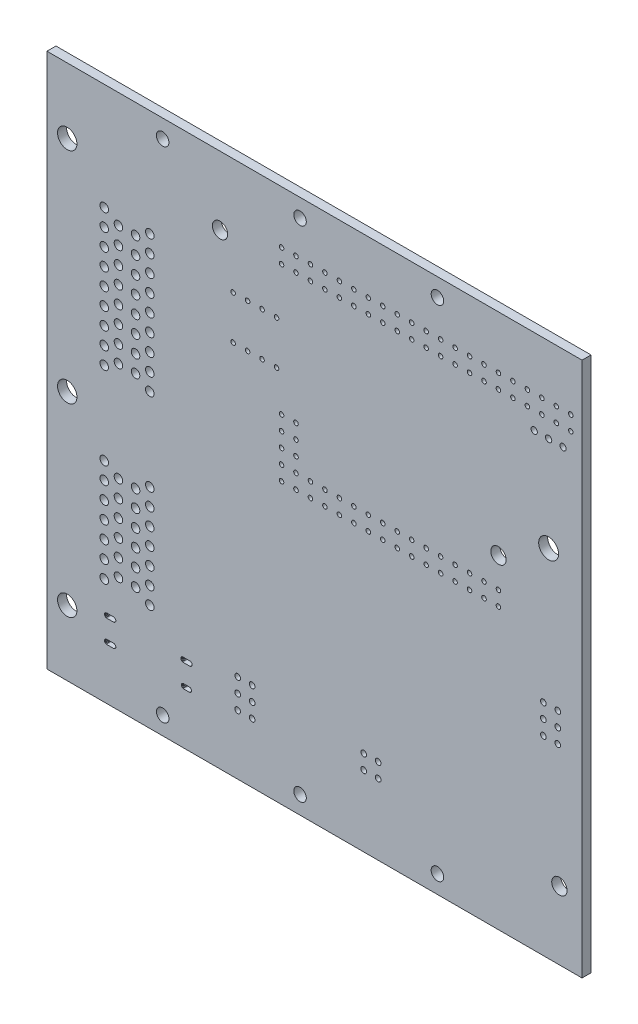
from build123d import *

# Parameters (mm, degrees)
SKETCH1_W           = 93.98
SKETCH1_H           = 93.98
SKETCH1_R           = 1.7
SKETCH1_R_2         = 1.1
SKETCH1_R_3         = 0.75
SKETCH1_R_4         = 1.35
SKETCH1_R_5         = 0.4
SKETCH1_R_6         = 0.55
SKETCH1_R_7         = 1.75
SKETCH1_R_8         = 0.5
BOSS_EXTRUDE1_DEPTH = 1.58


with BuildPart() as part:
    # Sketch1 → Boss-Extrude1 (new body)
    with BuildSketch(Plane.XY.offset(1.58)):
        with Locations((93.064, -92.796)):
            Rectangle(SKETCH1_W, SKETCH1_H)
        with Locations((49.633992, -57.295988)):
            Circle(SKETCH1_R, mode=Mode.SUBTRACT)
        with Locations((66.394, -48.981)):
            Circle(SKETCH1_R_2, mode=Mode.SUBTRACT)
        with Locations((56.133992, -64.545988)):
            Circle(SKETCH1_R_3, mode=Mode.SUBTRACT)
        with Locations((56.133992, -67.545988)):
            Circle(SKETCH1_R_3, mode=Mode.SUBTRACT)
        with Locations((58.633992, -66.045988)):
            Circle(SKETCH1_R_3, mode=Mode.SUBTRACT)
        with Locations((56.133992, -70.545988)):
            Circle(SKETCH1_R_3, mode=Mode.SUBTRACT)
        with Locations((58.633992, -69.045988)):
            Circle(SKETCH1_R_3, mode=Mode.SUBTRACT)
        with Locations((64.133992, -64.545988)):
            Circle(SKETCH1_R_3, mode=Mode.SUBTRACT)
        with Locations((61.633992, -66.045988)):
            Circle(SKETCH1_R_3, mode=Mode.SUBTRACT)
        with Locations((64.133992, -67.545988)):
            Circle(SKETCH1_R_3, mode=Mode.SUBTRACT)
        with Locations((61.633992, -69.045988)):
            Circle(SKETCH1_R_3, mode=Mode.SUBTRACT)
        with Locations((64.133992, -70.545988)):
            Circle(SKETCH1_R_3, mode=Mode.SUBTRACT)
        with Locations((76.474, -57.806)):
            Circle(SKETCH1_R_4, mode=Mode.SUBTRACT)
        with Locations((90.524, -48.981)):
            Circle(SKETCH1_R_2, mode=Mode.SUBTRACT)
        with Locations(Location((87.274, -55.066, 0), (0, 0, 180))):
            Circle(SKETCH1_R_5, mode=Mode.SUBTRACT)
        with Locations(Location((87.274, -57.606, 0), (0, 0, 180))):
            Circle(SKETCH1_R_5, mode=Mode.SUBTRACT)
        with Locations(Location((89.814, -55.066, 0), (0, 0, 180))):
            Circle(SKETCH1_R_5, mode=Mode.SUBTRACT)
        with Locations(Location((92.354, -55.066, 0), (0, 0, 180))):
            Circle(SKETCH1_R_5, mode=Mode.SUBTRACT)
        with Locations(Location((89.814, -57.606, 0), (0, 0, 180))):
            Circle(SKETCH1_R_5, mode=Mode.SUBTRACT)
        with Locations(Location((92.354, -57.606, 0), (0, 0, 180))):
            Circle(SKETCH1_R_5, mode=Mode.SUBTRACT)
        with Locations(Location((78.774, -66.1535, 0), (0, 0, 180))):
            Circle(SKETCH1_R_5, mode=Mode.SUBTRACT)
        with Locations(Location((81.314, -66.1535, 0), (0, 0, 180))):
            Circle(SKETCH1_R_5, mode=Mode.SUBTRACT)
        with Locations(Location((83.854, -66.1535, 0), (0, 0, 180))):
            Circle(SKETCH1_R_5, mode=Mode.SUBTRACT)
        with Locations(Location((86.394, -66.1535, 0), (0, 0, 180))):
            Circle(SKETCH1_R_5, mode=Mode.SUBTRACT)
        with Locations((56.133992, -73.545988)):
            Circle(SKETCH1_R_3, mode=Mode.SUBTRACT)
        with Locations((58.633992, -72.045988)):
            Circle(SKETCH1_R_3, mode=Mode.SUBTRACT)
        with Locations((58.633992, -75.045988)):
            Circle(SKETCH1_R_3, mode=Mode.SUBTRACT)
        with Locations((56.133992, -76.545988)):
            Circle(SKETCH1_R_3, mode=Mode.SUBTRACT)
        with Locations((58.633992, -78.045988)):
            Circle(SKETCH1_R_3, mode=Mode.SUBTRACT)
        with Locations((56.133992, -79.545988)):
            Circle(SKETCH1_R_3, mode=Mode.SUBTRACT)
        with Locations((58.633992, -81.045988)):
            Circle(SKETCH1_R_3, mode=Mode.SUBTRACT)
        with Locations((61.633992, -72.045988)):
            Circle(SKETCH1_R_3, mode=Mode.SUBTRACT)
        with Locations((64.133992, -73.545988)):
            Circle(SKETCH1_R_3, mode=Mode.SUBTRACT)
        with Locations((61.633992, -75.045988)):
            Circle(SKETCH1_R_3, mode=Mode.SUBTRACT)
        with Locations((61.633992, -78.045988)):
            Circle(SKETCH1_R_3, mode=Mode.SUBTRACT)
        with Locations((64.133992, -76.545988)):
            Circle(SKETCH1_R_3, mode=Mode.SUBTRACT)
        with Locations((61.633992, -81.045988)):
            Circle(SKETCH1_R_3, mode=Mode.SUBTRACT)
        with Locations((64.133992, -79.545988)):
            Circle(SKETCH1_R_3, mode=Mode.SUBTRACT)
        with Locations((56.133992, -82.545988)):
            Circle(SKETCH1_R_3, mode=Mode.SUBTRACT)
        with Locations((58.633992, -84.045988)):
            Circle(SKETCH1_R_3, mode=Mode.SUBTRACT)
        with Locations((56.133992, -85.545988)):
            Circle(SKETCH1_R_3, mode=Mode.SUBTRACT)
        with Locations((58.633992, -87.045988)):
            Circle(SKETCH1_R_3, mode=Mode.SUBTRACT)
        with Locations((56.133992, -88.545988)):
            Circle(SKETCH1_R_3, mode=Mode.SUBTRACT)
        with Locations((61.633992, -84.045988)):
            Circle(SKETCH1_R_3, mode=Mode.SUBTRACT)
        with Locations((64.133992, -82.545988)):
            Circle(SKETCH1_R_3, mode=Mode.SUBTRACT)
        with Locations((61.633992, -87.045988)):
            Circle(SKETCH1_R_3, mode=Mode.SUBTRACT)
        with Locations((64.133992, -85.545988)):
            Circle(SKETCH1_R_3, mode=Mode.SUBTRACT)
        with Locations((64.133992, -88.545988)):
            Circle(SKETCH1_R_3, mode=Mode.SUBTRACT)
        with Locations(Location((78.774, -73.7735, 0), (0, 0, 180))):
            Circle(SKETCH1_R_5, mode=Mode.SUBTRACT)
        with Locations(Location((81.314, -73.7735, 0), (0, 0, 180))):
            Circle(SKETCH1_R_5, mode=Mode.SUBTRACT)
        with Locations(Location((83.854, -73.7735, 0), (0, 0, 180))):
            Circle(SKETCH1_R_5, mode=Mode.SUBTRACT)
        with Locations(Location((86.394, -73.7735, 0), (0, 0, 180))):
            Circle(SKETCH1_R_5, mode=Mode.SUBTRACT)
        with Locations(Location((87.274, -80.466, 0), (0, 0, 180))):
            Circle(SKETCH1_R_5, mode=Mode.SUBTRACT)
        with Locations(Location((89.814, -80.466, 0), (0, 0, 180))):
            Circle(SKETCH1_R_5, mode=Mode.SUBTRACT)
        with Locations(Location((87.274, -83.006, 0), (0, 0, 180))):
            Circle(SKETCH1_R_5, mode=Mode.SUBTRACT)
        with Locations(Location((87.274, -85.546, 0), (0, 0, 180))):
            Circle(SKETCH1_R_5, mode=Mode.SUBTRACT)
        with Locations(Location((89.814, -83.006, 0), (0, 0, 180))):
            Circle(SKETCH1_R_5, mode=Mode.SUBTRACT)
        with Locations(Location((89.814, -85.546, 0), (0, 0, 180))):
            Circle(SKETCH1_R_5, mode=Mode.SUBTRACT)
        with Locations(Location((87.274, -88.086, 0), (0, 0, 180))):
            Circle(SKETCH1_R_5, mode=Mode.SUBTRACT)
        with Locations(Location((87.274, -90.626, 0), (0, 0, 180))):
            Circle(SKETCH1_R_5, mode=Mode.SUBTRACT)
        with Locations(Location((89.814, -88.086, 0), (0, 0, 180))):
            Circle(SKETCH1_R_5, mode=Mode.SUBTRACT)
        with Locations(Location((92.354, -88.086, 0), (0, 0, 180))):
            Circle(SKETCH1_R_5, mode=Mode.SUBTRACT)
        with Locations(Location((89.814, -90.626, 0), (0, 0, 180))):
            Circle(SKETCH1_R_5, mode=Mode.SUBTRACT)
        with Locations(Location((92.354, -90.626, 0), (0, 0, 180))):
            Circle(SKETCH1_R_5, mode=Mode.SUBTRACT)
        with Locations(Location((94.894, -55.066, 0), (0, 0, 180))):
            Circle(SKETCH1_R_5, mode=Mode.SUBTRACT)
        with Locations(Location((97.434, -55.066, 0), (0, 0, 180))):
            Circle(SKETCH1_R_5, mode=Mode.SUBTRACT)
        with Locations(Location((94.894, -57.606, 0), (0, 0, 180))):
            Circle(SKETCH1_R_5, mode=Mode.SUBTRACT)
        with Locations(Location((97.434, -57.606, 0), (0, 0, 180))):
            Circle(SKETCH1_R_5, mode=Mode.SUBTRACT)
        with Locations(Location((99.974, -55.066, 0), (0, 0, 180))):
            Circle(SKETCH1_R_5, mode=Mode.SUBTRACT)
        with Locations(Location((102.514, -55.066, 0), (0, 0, 180))):
            Circle(SKETCH1_R_5, mode=Mode.SUBTRACT)
        with Locations(Location((99.974, -57.606, 0), (0, 0, 180))):
            Circle(SKETCH1_R_5, mode=Mode.SUBTRACT)
        with Locations(Location((102.514, -57.606, 0), (0, 0, 180))):
            Circle(SKETCH1_R_5, mode=Mode.SUBTRACT)
        with Locations(Location((105.054, -55.066, 0), (0, 0, 180))):
            Circle(SKETCH1_R_5, mode=Mode.SUBTRACT)
        with Locations(Location((107.594, -55.066, 0), (0, 0, 180))):
            Circle(SKETCH1_R_5, mode=Mode.SUBTRACT)
        with Locations(Location((110.134, -55.066, 0), (0, 0, 180))):
            Circle(SKETCH1_R_5, mode=Mode.SUBTRACT)
        with Locations(Location((105.054, -57.606, 0), (0, 0, 180))):
            Circle(SKETCH1_R_5, mode=Mode.SUBTRACT)
        with Locations(Location((107.594, -57.606, 0), (0, 0, 180))):
            Circle(SKETCH1_R_5, mode=Mode.SUBTRACT)
        with Locations(Location((110.134, -57.606, 0), (0, 0, 180))):
            Circle(SKETCH1_R_5, mode=Mode.SUBTRACT)
        with Locations(Location((112.674, -55.066, 0), (0, 0, 180))):
            Circle(SKETCH1_R_5, mode=Mode.SUBTRACT)
        with Locations(Location((115.214, -55.066, 0), (0, 0, 180))):
            Circle(SKETCH1_R_5, mode=Mode.SUBTRACT)
        with Locations(Location((112.674, -57.606, 0), (0, 0, 180))):
            Circle(SKETCH1_R_5, mode=Mode.SUBTRACT)
        with Locations(Location((115.214, -57.606, 0), (0, 0, 180))):
            Circle(SKETCH1_R_5, mode=Mode.SUBTRACT)
        with Locations((114.654, -48.981)):
            Circle(SKETCH1_R_2, mode=Mode.SUBTRACT)
        with Locations(Location((117.754, -55.066, 0), (0, 0, 180))):
            Circle(SKETCH1_R_5, mode=Mode.SUBTRACT)
        with Locations(Location((120.294, -55.066, 0), (0, 0, 180))):
            Circle(SKETCH1_R_5, mode=Mode.SUBTRACT)
        with Locations(Location((117.754, -57.606, 0), (0, 0, 180))):
            Circle(SKETCH1_R_5, mode=Mode.SUBTRACT)
        with Locations(Location((120.294, -57.606, 0), (0, 0, 180))):
            Circle(SKETCH1_R_5, mode=Mode.SUBTRACT)
        with Locations(Location((122.834, -55.066, 0), (0, 0, 180))):
            Circle(SKETCH1_R_5, mode=Mode.SUBTRACT)
        with Locations(Location((125.374, -55.066, 0), (0, 0, 180))):
            Circle(SKETCH1_R_5, mode=Mode.SUBTRACT)
        with Locations(Location((122.834, -57.606, 0), (0, 0, 180))):
            Circle(SKETCH1_R_5, mode=Mode.SUBTRACT)
        with Locations(Location((125.374, -57.606, 0), (0, 0, 180))):
            Circle(SKETCH1_R_5, mode=Mode.SUBTRACT)
        with Locations(Location((127.914, -55.066, 0), (0, 0, 180))):
            Circle(SKETCH1_R_5, mode=Mode.SUBTRACT)
        with Locations(Location((130.454, -55.066, 0), (0, 0, 180))):
            Circle(SKETCH1_R_5, mode=Mode.SUBTRACT)
        with Locations(Location((127.914, -57.606, 0), (0, 0, 180))):
            Circle(SKETCH1_R_5, mode=Mode.SUBTRACT)
        with Locations(Location((130.454, -57.606, 0), (0, 0, 180))):
            Circle(SKETCH1_R_5, mode=Mode.SUBTRACT)
        with Locations(Location((132.994, -55.066, 0), (0, 0, 180))):
            Circle(SKETCH1_R_5, mode=Mode.SUBTRACT)
        with Locations(Location((135.534, -55.066, 0), (0, 0, 180))):
            Circle(SKETCH1_R_5, mode=Mode.SUBTRACT)
        with Locations(Location((138.074, -55.066, 0), (0, 0, 180))):
            Circle(SKETCH1_R_5, mode=Mode.SUBTRACT)
        with Locations(Location((132.994, -57.606, 0), (0, 0, 180))):
            Circle(SKETCH1_R_5, mode=Mode.SUBTRACT)
        with Locations(Location((135.534, -57.606, 0), (0, 0, 180))):
            Circle(SKETCH1_R_5, mode=Mode.SUBTRACT)
        with Locations(Location((138.074, -57.606, 0), (0, 0, 180))):
            Circle(SKETCH1_R_5, mode=Mode.SUBTRACT)
        with Locations(Location((131.644, -60.706, 0), (0, 0, 180))):
            Circle(SKETCH1_R_6, mode=Mode.SUBTRACT)
        with Locations(Location((134.184, -60.706, 0), (0, 0, 180))):
            Circle(SKETCH1_R_6, mode=Mode.SUBTRACT)
        with Locations(Location((136.724, -60.706, 0), (0, 0, 180))):
            Circle(SKETCH1_R_6, mode=Mode.SUBTRACT)
        with Locations(Location((94.894, -88.086, 0), (0, 0, 180))):
            Circle(SKETCH1_R_5, mode=Mode.SUBTRACT)
        with Locations(Location((97.434, -88.086, 0), (0, 0, 180))):
            Circle(SKETCH1_R_5, mode=Mode.SUBTRACT)
        with Locations(Location((94.894, -90.626, 0), (0, 0, 180))):
            Circle(SKETCH1_R_5, mode=Mode.SUBTRACT)
        with Locations(Location((97.434, -90.626, 0), (0, 0, 180))):
            Circle(SKETCH1_R_5, mode=Mode.SUBTRACT)
        with Locations(Location((99.974, -88.086, 0), (0, 0, 180))):
            Circle(SKETCH1_R_5, mode=Mode.SUBTRACT)
        with Locations(Location((102.514, -88.086, 0), (0, 0, 180))):
            Circle(SKETCH1_R_5, mode=Mode.SUBTRACT)
        with Locations(Location((99.974, -90.626, 0), (0, 0, 180))):
            Circle(SKETCH1_R_5, mode=Mode.SUBTRACT)
        with Locations(Location((102.514, -90.626, 0), (0, 0, 180))):
            Circle(SKETCH1_R_5, mode=Mode.SUBTRACT)
        with Locations(Location((105.054, -88.086, 0), (0, 0, 180))):
            Circle(SKETCH1_R_5, mode=Mode.SUBTRACT)
        with Locations(Location((107.594, -88.086, 0), (0, 0, 180))):
            Circle(SKETCH1_R_5, mode=Mode.SUBTRACT)
        with Locations(Location((110.134, -88.086, 0), (0, 0, 180))):
            Circle(SKETCH1_R_5, mode=Mode.SUBTRACT)
        with Locations(Location((105.054, -90.626, 0), (0, 0, 180))):
            Circle(SKETCH1_R_5, mode=Mode.SUBTRACT)
        with Locations(Location((107.594, -90.626, 0), (0, 0, 180))):
            Circle(SKETCH1_R_5, mode=Mode.SUBTRACT)
        with Locations(Location((110.134, -90.626, 0), (0, 0, 180))):
            Circle(SKETCH1_R_5, mode=Mode.SUBTRACT)
        with Locations(Location((112.674, -88.086, 0), (0, 0, 180))):
            Circle(SKETCH1_R_5, mode=Mode.SUBTRACT)
        with Locations(Location((115.214, -88.086, 0), (0, 0, 180))):
            Circle(SKETCH1_R_5, mode=Mode.SUBTRACT)
        with Locations(Location((112.674, -90.626, 0), (0, 0, 180))):
            Circle(SKETCH1_R_5, mode=Mode.SUBTRACT)
        with Locations(Location((115.214, -90.626, 0), (0, 0, 180))):
            Circle(SKETCH1_R_5, mode=Mode.SUBTRACT)
        with Locations((134.184, -77.366)):
            Circle(SKETCH1_R_7, mode=Mode.SUBTRACT)
        with Locations((125.374, -82.856)):
            Circle(SKETCH1_R_4, mode=Mode.SUBTRACT)
        with Locations(Location((117.754, -88.086, 0), (0, 0, 180))):
            Circle(SKETCH1_R_5, mode=Mode.SUBTRACT)
        with Locations(Location((120.294, -88.086, 0), (0, 0, 180))):
            Circle(SKETCH1_R_5, mode=Mode.SUBTRACT)
        with Locations(Location((117.754, -90.626, 0), (0, 0, 180))):
            Circle(SKETCH1_R_5, mode=Mode.SUBTRACT)
        with Locations(Location((120.294, -90.626, 0), (0, 0, 180))):
            Circle(SKETCH1_R_5, mode=Mode.SUBTRACT)
        with Locations(Location((122.834, -88.086, 0), (0, 0, 180))):
            Circle(SKETCH1_R_5, mode=Mode.SUBTRACT)
        with Locations(Location((125.374, -88.086, 0), (0, 0, 180))):
            Circle(SKETCH1_R_5, mode=Mode.SUBTRACT)
        with Locations(Location((122.834, -90.626, 0), (0, 0, 180))):
            Circle(SKETCH1_R_5, mode=Mode.SUBTRACT)
        with Locations(Location((125.374, -90.626, 0), (0, 0, 180))):
            Circle(SKETCH1_R_5, mode=Mode.SUBTRACT)
        with Locations((49.633992, -95.795988)):
            Circle(SKETCH1_R, mode=Mode.SUBTRACT)
        with Locations((56.133992, -103.045988)):
            Circle(SKETCH1_R_3, mode=Mode.SUBTRACT)
        with Locations((64.133992, -103.045988)):
            Circle(SKETCH1_R_3, mode=Mode.SUBTRACT)
        with Locations((56.133992, -106.045988)):
            Circle(SKETCH1_R_3, mode=Mode.SUBTRACT)
        with Locations((58.633992, -104.545988)):
            Circle(SKETCH1_R_3, mode=Mode.SUBTRACT)
        with Locations((56.133992, -109.045988)):
            Circle(SKETCH1_R_3, mode=Mode.SUBTRACT)
        with Locations((58.633992, -107.545988)):
            Circle(SKETCH1_R_3, mode=Mode.SUBTRACT)
        with Locations((58.633992, -110.545988)):
            Circle(SKETCH1_R_3, mode=Mode.SUBTRACT)
        with Locations((56.133992, -112.045988)):
            Circle(SKETCH1_R_3, mode=Mode.SUBTRACT)
        with Locations((58.633992, -113.545988)):
            Circle(SKETCH1_R_3, mode=Mode.SUBTRACT)
        with Locations((61.633992, -104.545988)):
            Circle(SKETCH1_R_3, mode=Mode.SUBTRACT)
        with Locations((64.133992, -106.045988)):
            Circle(SKETCH1_R_3, mode=Mode.SUBTRACT)
        with Locations((61.633992, -107.545988)):
            Circle(SKETCH1_R_3, mode=Mode.SUBTRACT)
        with Locations((64.133992, -109.045988)):
            Circle(SKETCH1_R_3, mode=Mode.SUBTRACT)
        with Locations((61.633992, -110.545988)):
            Circle(SKETCH1_R_3, mode=Mode.SUBTRACT)
        with Locations((61.633992, -113.545988)):
            Circle(SKETCH1_R_3, mode=Mode.SUBTRACT)
        with Locations((64.133992, -112.045988)):
            Circle(SKETCH1_R_3, mode=Mode.SUBTRACT)
        with Locations((56.133992, -115.045988)):
            Circle(SKETCH1_R_3, mode=Mode.SUBTRACT)
        with Locations((58.633992, -116.545988)):
            Circle(SKETCH1_R_3, mode=Mode.SUBTRACT)
        with Locations((56.133992, -118.045988)):
            Circle(SKETCH1_R_3, mode=Mode.SUBTRACT)
        with Locations((58.633992, -119.545988)):
            Circle(SKETCH1_R_3, mode=Mode.SUBTRACT)
        with Locations((56.133992, -121.045988)):
            Circle(SKETCH1_R_3, mode=Mode.SUBTRACT)
        with Locations((61.633992, -116.545988)):
            Circle(SKETCH1_R_3, mode=Mode.SUBTRACT)
        with Locations((64.133992, -115.045988)):
            Circle(SKETCH1_R_3, mode=Mode.SUBTRACT)
        with Locations((61.633992, -119.545988)):
            Circle(SKETCH1_R_3, mode=Mode.SUBTRACT)
        with Locations((64.133992, -118.045988)):
            Circle(SKETCH1_R_3, mode=Mode.SUBTRACT)
        with Locations((64.133992, -121.045988)):
            Circle(SKETCH1_R_3, mode=Mode.SUBTRACT)
        with Locations((49.633992, -128.295988)):
            Circle(SKETCH1_R, mode=Mode.SUBTRACT)
        with Locations((66.394, -136.631)):
            Circle(SKETCH1_R_2, mode=Mode.SUBTRACT)
        with Locations(Location((79.574, -124.226, 0), (0, 0, 180))):
            Circle(SKETCH1_R_8, mode=Mode.SUBTRACT)
        with Locations(Location((82.114, -124.226, 0), (0, 0, 180))):
            Circle(SKETCH1_R_8, mode=Mode.SUBTRACT)
        with Locations(Location((79.574, -126.766, 0), (0, 0, 180))):
            Circle(SKETCH1_R_8, mode=Mode.SUBTRACT)
        with Locations(Location((79.574, -129.306, 0), (0, 0, 180))):
            Circle(SKETCH1_R_8, mode=Mode.SUBTRACT)
        with Locations(Location((82.114, -126.766, 0), (0, 0, 180))):
            Circle(SKETCH1_R_8, mode=Mode.SUBTRACT)
        with Locations(Location((82.114, -129.306, 0), (0, 0, 180))):
            Circle(SKETCH1_R_8, mode=Mode.SUBTRACT)
        with Locations((90.524, -136.631)):
            Circle(SKETCH1_R_2, mode=Mode.SUBTRACT)
        with Locations(Location((133.259, -101.251, 0), (0, 0, 180))):
            Circle(SKETCH1_R_8, mode=Mode.SUBTRACT)
        with Locations(Location((133.259, -103.791, 0), (0, 0, 180))):
            Circle(SKETCH1_R_8, mode=Mode.SUBTRACT)
        with Locations(Location((135.799, -101.251, 0), (0, 0, 180))):
            Circle(SKETCH1_R_8, mode=Mode.SUBTRACT)
        with Locations(Location((135.799, -103.791, 0), (0, 0, 180))):
            Circle(SKETCH1_R_8, mode=Mode.SUBTRACT)
        with Locations(Location((133.259, -106.331, 0), (0, 0, 180))):
            Circle(SKETCH1_R_8, mode=Mode.SUBTRACT)
        with Locations(Location((135.799, -106.331, 0), (0, 0, 180))):
            Circle(SKETCH1_R_8, mode=Mode.SUBTRACT)
        with Locations(Location((101.709, -124.806, 0), (0, 0, 180))):
            Circle(SKETCH1_R_8, mode=Mode.SUBTRACT)
        with Locations(Location((104.249, -124.806, 0), (0, 0, 180))):
            Circle(SKETCH1_R_8, mode=Mode.SUBTRACT)
        with Locations(Location((101.709, -127.346, 0), (0, 0, 180))):
            Circle(SKETCH1_R_8, mode=Mode.SUBTRACT)
        with Locations(Location((104.249, -127.346, 0), (0, 0, 180))):
            Circle(SKETCH1_R_8, mode=Mode.SUBTRACT)
        with Locations((114.654, -136.631)):
            Circle(SKETCH1_R_2, mode=Mode.SUBTRACT)
        with Locations((136.074, -127.806)):
            Circle(SKETCH1_R_4, mode=Mode.SUBTRACT)
        Polygon((58.009114, -126.077393), (58.097607, -126.165886), (58.154423, -126.277393), (58.174, -126.401), (58.154423, -126.524607), (58.097607, -126.636114), (58.009114, -126.724607), (57.897607, -126.781423), (57.774, -126.801), (56.574, -126.801), (56.450393, -126.781423), (56.338886, -126.724607), (56.250393, -126.636114), (56.193577, -126.524607), (56.174, -126.401), (56.193577, -126.277393), (56.250393, -126.165886), (56.338886, -126.077393), (56.450393, -126.020577), (56.574, -126.001), (57.774, -126.001), (57.897607, -126.020577), align=None, mode=Mode.SUBTRACT)
        Polygon((58.009114, -130.077393), (58.097607, -130.165886), (58.154423, -130.277393), (58.174, -130.401), (58.154423, -130.524607), (58.097607, -130.636114), (58.009114, -130.724607), (57.897607, -130.781423), (57.774, -130.801), (56.574, -130.801), (56.450393, -130.781423), (56.338886, -130.724607), (56.250393, -130.636114), (56.193577, -130.524607), (56.174, -130.401), (56.193577, -130.277393), (56.250393, -130.165886), (56.338886, -130.077393), (56.450393, -130.020577), (56.574, -130.001), (57.774, -130.001), (57.897607, -130.020577), align=None, mode=Mode.SUBTRACT)
        Polygon((71.409114, -126.077393), (71.497607, -126.165886), (71.554423, -126.277393), (71.574, -126.401), (71.554423, -126.524607), (71.497607, -126.636114), (71.409114, -126.724607), (71.297607, -126.781423), (71.174, -126.801), (69.974, -126.801), (69.850393, -126.781423), (69.738886, -126.724607), (69.650393, -126.636114), (69.593577, -126.524607), (69.574, -126.401), (69.593577, -126.277393), (69.650393, -126.165886), (69.738886, -126.077393), (69.850393, -126.020577), (69.974, -126.001), (71.174, -126.001), (71.297607, -126.020577), align=None, mode=Mode.SUBTRACT)
        Polygon((71.309114, -130.077393), (71.397607, -130.165886), (71.454423, -130.277393), (71.474, -130.401), (71.454423, -130.524607), (71.397607, -130.636114), (71.309114, -130.724607), (71.197607, -130.781423), (71.074, -130.801), (70.074, -130.801), (69.950393, -130.781423), (69.838886, -130.724607), (69.750393, -130.636114), (69.693577, -130.524607), (69.674, -130.401), (69.693577, -130.277393), (69.750393, -130.165886), (69.838886, -130.077393), (69.950393, -130.020577), (70.074, -130.001), (71.074, -130.001), (71.197607, -130.020577), align=None, mode=Mode.SUBTRACT)
    extrude(amount=-BOSS_EXTRUDE1_DEPTH)


solid = part.part
